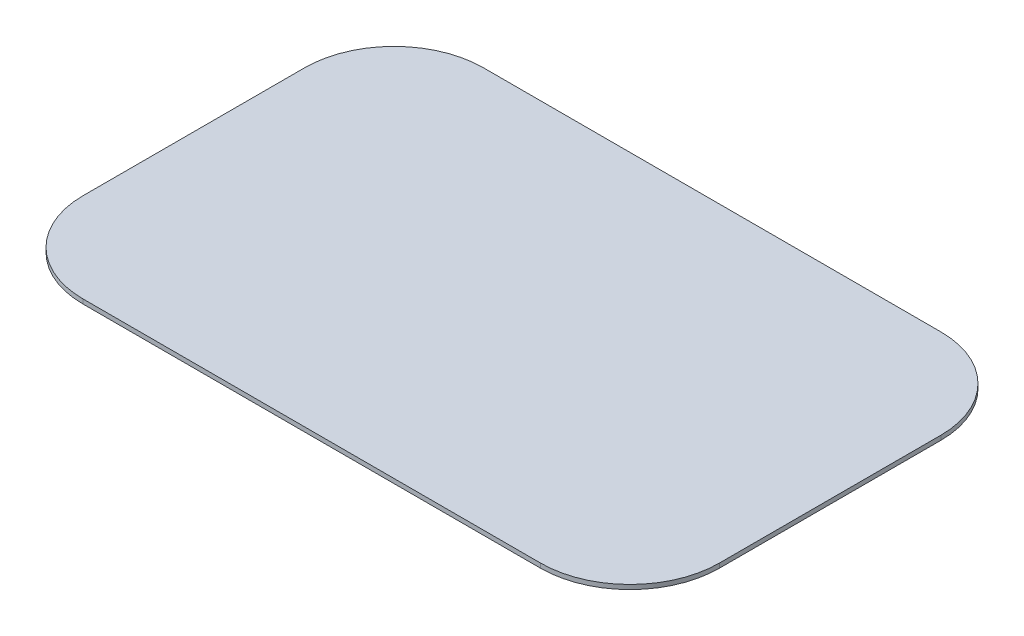
from build123d import *

# Parameters (mm, degrees)
DODANIE_WYCI_GNI_CIE1_DEPTH = 50


with BuildPart() as part:
    # Szkic1 → Dodanie-wyciągnięcie1 (new body)
    with BuildSketch(Plane(origin=(0, 0, 0), x_dir=(1, 0, 0), z_dir=(0, 1, 0))):
        with BuildLine():
            Line((1000, 0), (6120, 0))
            ThreePointArc((6120, 0), (6827.106781187, -292.893218813), (7120, -1000))
            Line((7120, -1000), (7120, -3480))
            ThreePointArc((7120, -3480), (6827.106781187, -4187.106781187), (6120, -4480))
            Line((6120, -4480), (1000, -4480))
            ThreePointArc((1000, -4480), (292.893218813, -4187.106781187), (0, -3480))
            Line((0, -3480), (0, -1000))
            ThreePointArc((0, -1000), (292.893218813, -292.893218813), (1000, 0))
        make_face()
    extrude(amount=-DODANIE_WYCI_GNI_CIE1_DEPTH)


solid = part.part
